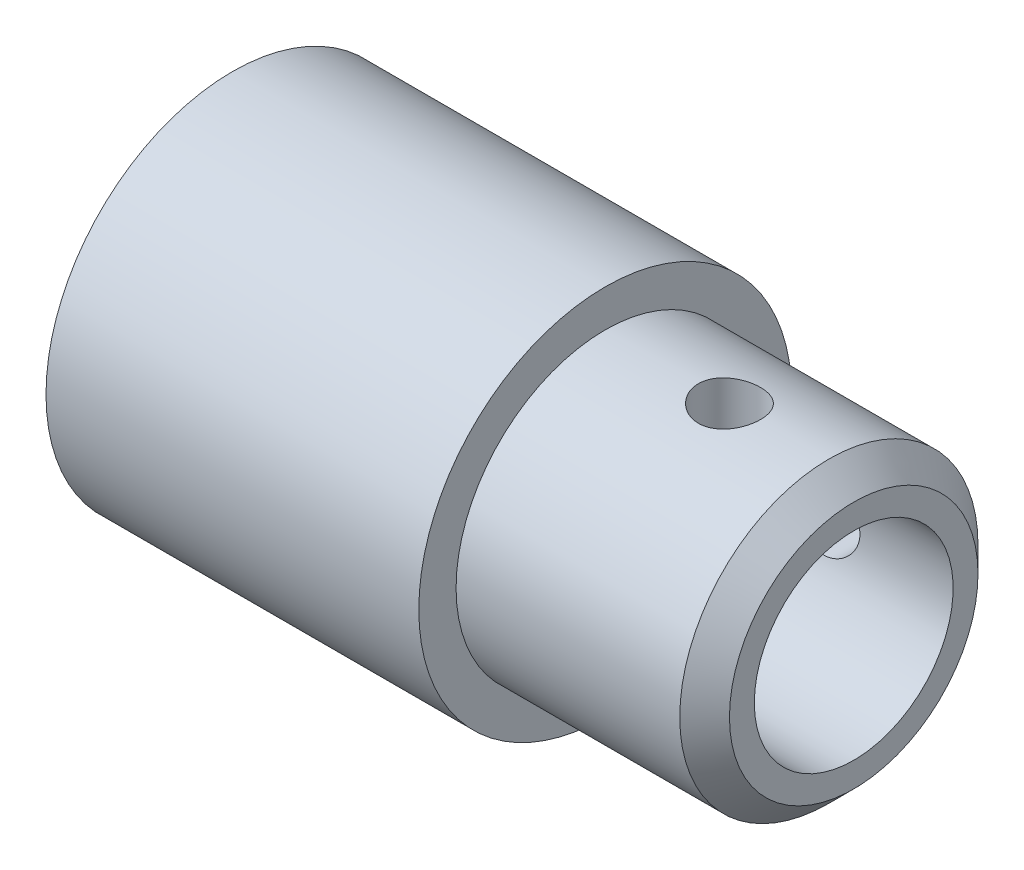
from build123d import *

# Parameters (mm, degrees)
SKETCH1_W           = 25
SKETCH1_H           = 2
SKETCH2_W           = 15
SKETCH2_H           = 3.5
TAPPED_HOLE1_REACH  = 31.385
TAPPED_HOLE1_BORE_R = 1.25
CIRPATTERN1_COUNT   = 2
CIRPATTERN1_ANGLE   = 90
CHAMFER1_SIZE       = 1


with BuildPart() as part:
    # Sketch1 → Revolve1 (revolve)
    with BuildSketch(Plane.XY, mode=Mode.PRIVATE) as revolve1_sk:
        with Locations((12.5, 5)):
            Rectangle(SKETCH1_W, SKETCH1_H)
    revolve(revolve1_sk.sketch.rotate(Axis((0, 0, 0), (1, 0, 0)), 90), axis=Axis((0, 0, 0), (1, 0, 0)))

    # Sketch2 → Revolve2 (revolve)
    with BuildSketch(Plane.XY, mode=Mode.PRIVATE) as revolve2_sk:
        with Locations((7.5, 5.75)):
            Rectangle(SKETCH2_W, SKETCH2_H)
    revolve(revolve2_sk.sketch.rotate(Axis((0, 0, 0), (1, 0, 0)), 90), axis=Axis((0, 0, 0), (1, 0, 0)))

    # Tapped Hole1 bore → Tapped Hole1 (cut, up to next)
    with BuildSketch(Plane(origin=(0, 6, 0), x_dir=(1, 0, 0), z_dir=(0, 1, 0)), mode=Mode.PRIVATE) as tapped_hole1_sk1:
        with Locations((20, 0)):
            Circle(TAPPED_HOLE1_BORE_R)
    tapped_hole1_tool1 = extrude(tapped_hole1_sk1.sketch, amount=-TAPPED_HOLE1_REACH, mode=Mode.PRIVATE) & part.part
    tapped_hole1 = tapped_hole1_tool1.solids().sort_by_distance((20, 6, 0))[0]
    add(tapped_hole1, mode=Mode.SUBTRACT)

    # CirPattern1: Tapped Hole1 ×2 about axis
    cirpattern1_axis = Axis((0, 0, 0), (-1, 0, 0))
    for i in range(1, CIRPATTERN1_COUNT):
        add(tapped_hole1.rotate(cirpattern1_axis, i * CIRPATTERN1_ANGLE / (CIRPATTERN1_COUNT - 1)), mode=Mode.SUBTRACT)

    # Chamfer1
    chamfer1_edges = [part.edges().sort_by_distance(p)[0] for p in [
        (25, 0, -6),
    ]]
    chamfer(chamfer1_edges, length=CHAMFER1_SIZE)


solid = part.part
